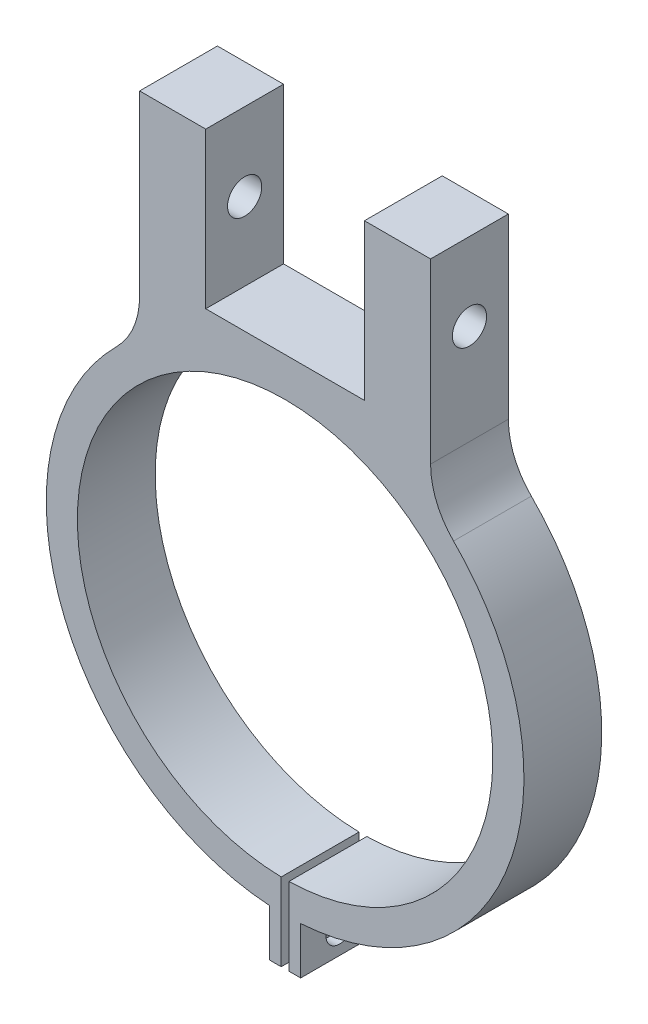
from build123d import *

# Parameters (mm, degrees)
AUFSATZ_LINEAR_AUSTRAGEN1_DEPTH = 10
SKIZZE2_R                       = 1.75
SCHNITT_LINEAR_AUSTRAGEN1_DEPTH = 62.985320843
SKIZZE4_R                       = 2.2
SCHNITT_LINEAR_AUSTRAGEN3_DEPTH = 73.202839279
VERRUNDUNG1_R                   = 10


with BuildPart() as part:
    # Skizze1 → Aufsatz-Linear austragen1 (new body)
    with BuildSketch(Plane.XY):
        with BuildLine():
            Line((0.5, -26.695317942), (0.5, -30.695928069))
            Line((0.5, -30.695928069), (0.5, -36.695928069))
            Line((0.5, -36.695928069), (2, -36.695928069))
            Line((2, -36.695928069), (2, -30.634784151))
            ThreePointArc((2, -30.634784151), (29.374903671, -8.922165338), (18.7, 24.34748447))
            Line((18.7, 24.34748447), (18.7, 51.7))
            Line((18.7, 51.7), (10.2, 51.7))
            Line((10.2, 51.7), (10.2, 31.7))
            Line((10.2, 31.7), (-10.2, 31.7))
            Line((-10.2, 31.7), (-10.2, 51.7))
            Line((-10.2, 51.7), (-18.7, 51.7))
            Line((-18.7, 51.7), (-18.7, 24.34748447))
            ThreePointArc((-18.7, 24.34748447), (-29.374903671, -8.922165338), (-2, -30.634784151))
            Line((-2, -30.634784151), (-2, -36.695928069))
            Line((-2, -36.695928069), (-0.5, -36.695928069))
            Line((-0.5, -36.695928069), (-0.5, -30.695928069))
            Line((-0.5, -30.695928069), (-0.5, -26.695317942))
            ThreePointArc((-0.5, -26.695317942), (0, 26.7), (0.5, -26.695317942))
        make_face()
    extrude(amount=AUFSATZ_LINEAR_AUSTRAGEN1_DEPTH)

    # Skizze2 → Schnitt-Linear austragen1 (cut, through all)
    with BuildSketch(Plane.ZY.offset(2)):
        with Locations(Location((5, -33.66535611, 0), (0, 0, 90))):
            Circle(SKIZZE2_R)
    extrude(amount=-SCHNITT_LINEAR_AUSTRAGEN1_DEPTH, mode=Mode.SUBTRACT)

    # Skizze4 → Schnitt-Linear austragen3 (cut, through all)
    with BuildSketch(Plane.ZY.offset(18.7)):
        with Locations(Location((5, 41.7, 0), (0, 0, 270))):
            Circle(SKIZZE4_R)
    extrude(amount=-SCHNITT_LINEAR_AUSTRAGEN3_DEPTH, mode=Mode.SUBTRACT)

    # Verrundung1
    verrundung1_edges = [part.edges().sort_by_distance(p)[0] for p in [
        (-18.7, 24.34748447, 5),
        (18.7, 24.34748447, 5),
    ]]
    fillet(verrundung1_edges, radius=VERRUNDUNG1_R)


solid = part.part
